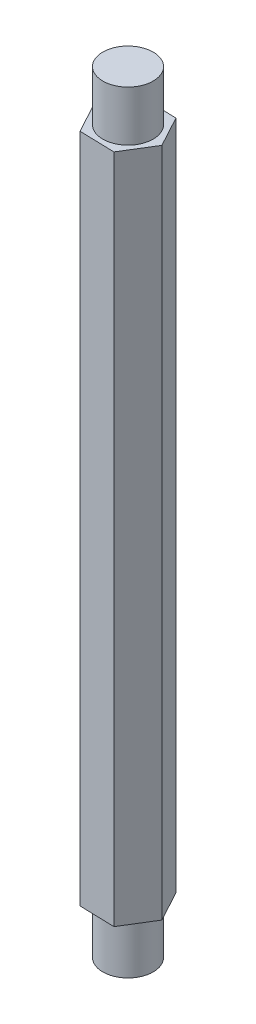
from build123d import *

# Parameters (mm, degrees)
SKETCH1_R           = 1.5
BOSS_EXTRUDE1_DEPTH = 3
BOSS_EXTRUDE2_DEPTH = 40
SKETCH3_R           = 1.5
BOSS_EXTRUDE3_DEPTH = 3


with BuildPart() as part:
    # Sketch1 → Boss-Extrude1 (new body)
    with BuildSketch(Plane(origin=(0, 0, 0), x_dir=(1, 0, 0), z_dir=(0, 1, 0))):
        with Locations(Location((0, 0, 0), (0, 0, 270))):
            Circle(SKETCH1_R)
    extrude(amount=BOSS_EXTRUDE1_DEPTH)

    # Sketch2 → Boss-Extrude2 (add)
    with BuildSketch(Plane(origin=(0, 3, 0), x_dir=(1, 0, 0), z_dir=(0, 1, 0))):
        Polygon((-0.98915483, 1.827996915), (-2.077669182, 0.057365247), (-1.088514352, -1.770631668), (0.98915483, -1.827996915), (2.077669182, -0.057365247), (1.088514352, 1.770631668), align=None)
    extrude(amount=BOSS_EXTRUDE2_DEPTH)

    # Sketch3 → Boss-Extrude3 (add)
    with BuildSketch(Plane(origin=(0, 43, 0), x_dir=(1, 0, 0), z_dir=(0, 1, 0))):
        with Locations(Location((0, 0, 0), (0, 0, 270))):
            Circle(SKETCH3_R)
    extrude(amount=BOSS_EXTRUDE3_DEPTH)


solid = part.part
